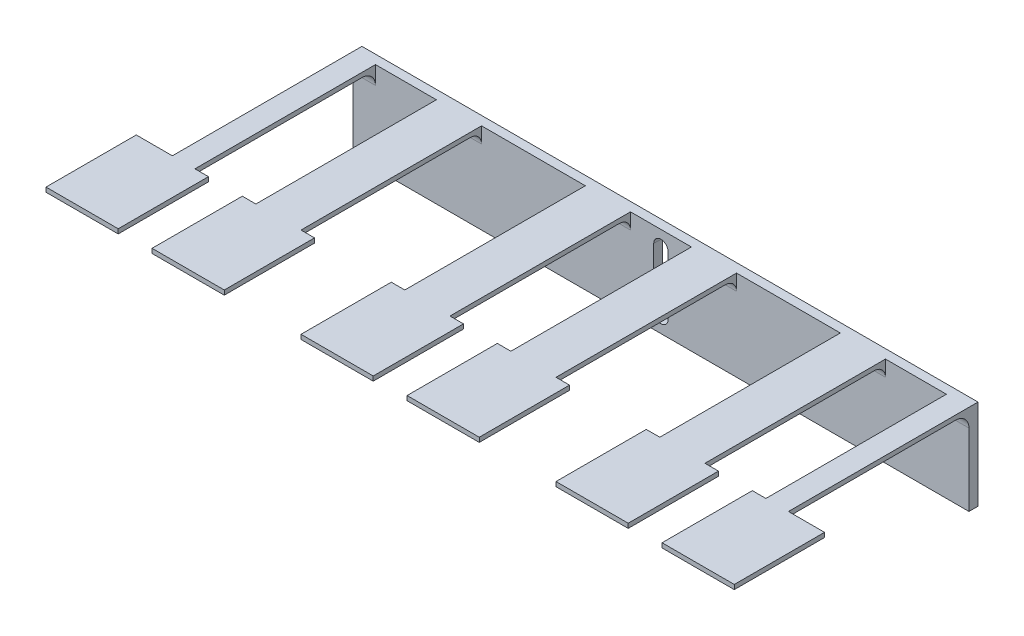
from build123d import *

# Parameters (mm, degrees)
SKETCH1_W                 = 146.5
SKETCH1_H                 = 20
BOSS_EXTRUDE1_DEPTH       = 2
SKETCH2_W                 = 10
SKETCH2_H                 = 1
BOSS_EXTRUDE2_DEPTH       = 60
SKETCH3_W                 = 20
SKETCH3_H                 = 1
BOSS_EXTRUDE3_DEPTH       = 3
SKETCH4_W                 = 20
SKETCH4_H                 = 1
BOSS_EXTRUDE4_DEPTH       = 3
BOSS_EXTRUDE5_DEPTH       = 3
BOSS_EXTRUDE5_DEPTH_BACK  = 13
SKETCH5_W                 = 20
SKETCH5_H                 = 1
BOSS_EXTRUDE7_DEPTH       = 3
BOSS_EXTRUDE7_DEPTH_BACK  = 13
SKETCH7_W                 = 20
SKETCH7_H                 = 1
BOSS_EXTRUDE9_DEPTH       = 3
BOSS_EXTRUDE9_DEPTH_BACK  = 13
SKETCH9_W                 = 20
SKETCH9_H                 = 1
BOSS_EXTRUDE11_DEPTH      = 3
BOSS_EXTRUDE11_DEPTH_BACK = 13
SKETCH11_W                = 20
SKETCH11_H                = 1
SKETCH13_W                = 30
SKETCH13_H                = 1
BOSS_EXTRUDE13_DEPTH      = 3
SKETCH14_W                = 20
SKETCH14_H                = 1
BOSS_EXTRUDE14_DEPTH      = 3
CUT_EXTRUDE1_DEPTH        = 3
SKETCH16_W                = 5
SKETCH16_H                = 20
CUT_EXTRUDE2_DEPTH        = 10
SKETCH17_W                = 5
SKETCH17_H                = 40
SKETCH17_W_2              = 8
CUT_EXTRUDE3_DEPTH        = 10
FILLET1_R                 = 3
FILLET2_R                 = 2.5


with BuildPart() as part:
    # Sketch1 → Boss-Extrude1 (new body)
    with BuildSketch(Plane.XY):
        with Locations((-1709.906073211, 816.567138103)):
            Rectangle(SKETCH1_W, SKETCH1_H)
    extrude(amount=BOSS_EXTRUDE1_DEPTH)

    # Sketch2 → Boss-Extrude2 (add)
    with BuildSketch(Plane.XY.offset(2)):
        with Locations((-1778.156073211, 826.067138103)):
            Rectangle(SKETCH2_W, SKETCH2_H)
        with Locations((-1754.656073211, 826.067138103)):
            Rectangle(SKETCH2_W, SKETCH2_H)
        with Locations((-1641.656073211, 826.067138103)):
            Rectangle(SKETCH2_W, SKETCH2_H)
        with Locations((-1665.156073211, 826.067138103)):
            Rectangle(SKETCH2_W, SKETCH2_H)
        with Locations((-1721.656073211, 826.067138103)):
            Rectangle(SKETCH2_W, SKETCH2_H)
        with Locations((-1698.156073211, 826.067138103)):
            Rectangle(SKETCH2_W, SKETCH2_H)
    extrude(amount=BOSS_EXTRUDE2_DEPTH)

    # Sketch3 → Boss-Extrude3 (add)
    with BuildSketch(Plane.ZY.offset(1783.156073211)):
        with Locations((52, 826.067138103)):
            Rectangle(SKETCH3_W, SKETCH3_H)
    extrude(amount=BOSS_EXTRUDE3_DEPTH)

    # Sketch4 → Boss-Extrude4 (add)
    with BuildSketch(Plane(origin=(-1773.156073211, 0, 0), x_dir=(0, 0, -1), z_dir=(1, 0, 0))):
        with Locations((-52, 826.067138104)):
            Rectangle(SKETCH4_W, SKETCH4_H)
    extrude(amount=BOSS_EXTRUDE4_DEPTH)

    # Sketch5 → Boss-Extrude5 (add, two sides: drawn at the far end of the back side and taken through both)
    with BuildSketch(Plane.ZY.offset(1759.656073211).offset(-BOSS_EXTRUDE5_DEPTH_BACK)):
        with Locations((52, 826.067138103)):
            Rectangle(SKETCH5_W, SKETCH5_H)
    extrude(amount=BOSS_EXTRUDE5_DEPTH + BOSS_EXTRUDE5_DEPTH_BACK)

    # Sketch7 → Boss-Extrude7 (add, two sides: drawn at the far end of the back side and taken through both)
    with BuildSketch(Plane.ZY.offset(1726.656073211).offset(-BOSS_EXTRUDE7_DEPTH_BACK)):
        with Locations((52, 826.067138103)):
            Rectangle(SKETCH7_W, SKETCH7_H)
    extrude(amount=BOSS_EXTRUDE7_DEPTH + BOSS_EXTRUDE7_DEPTH_BACK)

    # Sketch9 → Boss-Extrude9 (add, two sides: drawn at the far end of the back side and taken through both)
    with BuildSketch(Plane.ZY.offset(1703.156073211).offset(-BOSS_EXTRUDE9_DEPTH_BACK)):
        with Locations((52, 826.067138103)):
            Rectangle(SKETCH9_W, SKETCH9_H)
    extrude(amount=BOSS_EXTRUDE9_DEPTH + BOSS_EXTRUDE9_DEPTH_BACK)

    # Sketch11 → Boss-Extrude11 (add, two sides: drawn at the far end of the back side and taken through both)
    with BuildSketch(Plane.ZY.offset(1670.156073211).offset(-BOSS_EXTRUDE11_DEPTH_BACK)):
        with Locations((52, 826.067138103)):
            Rectangle(SKETCH11_W, SKETCH11_H)
    extrude(amount=BOSS_EXTRUDE11_DEPTH + BOSS_EXTRUDE11_DEPTH_BACK)

    # Sketch13 → Boss-Extrude13 (add)
    with BuildSketch(Plane(origin=(-1636.656073211, 0, 0), x_dir=(0, 0, -1), z_dir=(1, 0, 0))):
        with Locations((-47, 826.067138103)):
            Rectangle(SKETCH13_W, SKETCH13_H)
    extrude(amount=BOSS_EXTRUDE13_DEPTH)

    # Sketch14 → Boss-Extrude14 (add)
    with BuildSketch(Plane.ZY.offset(1646.656073212)):
        with Locations((52, 826.067138102)):
            Rectangle(SKETCH14_W, SKETCH14_H)
    extrude(amount=BOSS_EXTRUDE14_DEPTH)

    # Sketch15 → Cut-Extrude1 (cut)
    with BuildSketch(Plane.XY.offset(2)):
        with BuildLine():
            Line((-1711.506073211, 810.067138103), (-1711.506073211, 823.067138103))
            ThreePointArc((-1711.506073211, 823.067138103), (-1709.906073211, 824.667138103), (-1708.306073211, 823.067138103))
            Line((-1708.306073211, 823.067138103), (-1708.306073211, 810.067138103))
            ThreePointArc((-1708.306073211, 810.067138103), (-1709.906073211, 808.467138103), (-1711.506073211, 810.067138103))
        make_face()
    extrude(amount=-CUT_EXTRUDE1_DEPTH, mode=Mode.SUBTRACT)

    # Sketch16 → Cut-Extrude2 (cut)
    with BuildSketch(Plane.XY.offset(2)):
        with Locations((-1780.656073211, 816.567138103)):
            Rectangle(SKETCH16_W, SKETCH16_H)
        with Locations((-1639.156073211, 816.567138103)):
            Rectangle(SKETCH16_W, SKETCH16_H)
    extrude(amount=-CUT_EXTRUDE2_DEPTH, mode=Mode.SUBTRACT)

    # Sketch17 → Cut-Extrude3 (cut)
    with BuildSketch(Plane.XZ.offset(-825.567138103)):
        with Locations((-1780.656073211, 22)):
            Rectangle(SKETCH17_W, SKETCH17_H)
        with Locations((-1637.656073211, 22)):
            Rectangle(SKETCH17_W_2, SKETCH17_H)
    extrude(amount=-CUT_EXTRUDE3_DEPTH, mode=Mode.SUBTRACT)

    # Fillet1
    fillet1_edges = [part.edges().sort_by_distance(p)[0] for p in [
        (-1775.656073211, 825.567138103, 2),
        (-1644.156073211, 825.567138103, 2),
    ]]
    fillet(fillet1_edges, radius=FILLET1_R)

    # Fillet2
    fillet2_edges = [part.edges().sort_by_distance(p)[0] for p in [
        (-1754.656073211, 825.567138103, 2),
        (-1665.156073211, 825.567138103, 2),
        (-1721.656073211, 825.567138103, 2),
        (-1698.156073211, 825.567138103, 2),
    ]]
    fillet(fillet2_edges, radius=FILLET2_R)


solid = part.part
